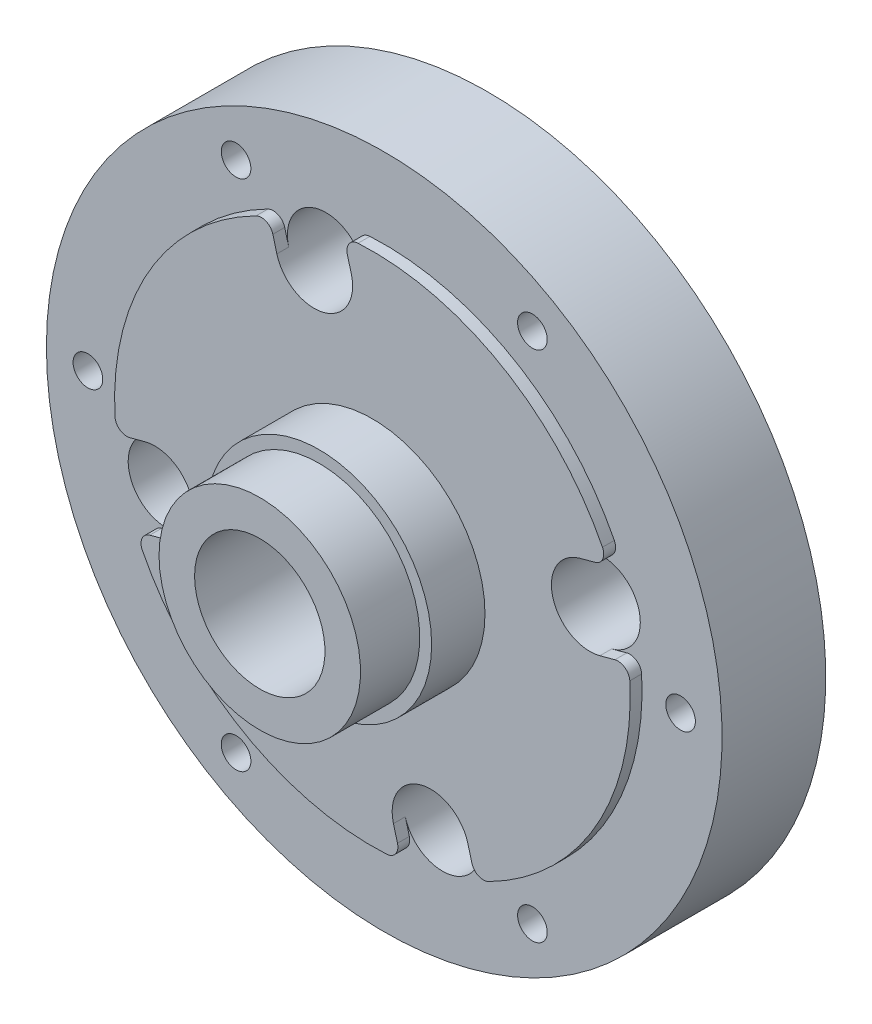
from build123d import *

# Parameters (mm, degrees)
SKETCH_1_W                    = 28.5
SKETCH_1_H                    = 8.75
EXTRUDE_1_DEPTH               = 1
HOLE_WIZARD_M10_1_D           = 11
HOLE_WIZARD_M10_1_CBORE_D     = 28.5
HOLE_WIZARD_M10_1_CBORE_DEPTH = 6.75
HOLE_WIZARD_2_5_2_5_1_D       = 2.5
HOLE_WIZARD_2_5_2_5_1_DEPTH   = 19.25
FILLET_1_R                    = 1


with BuildPart() as part:
    # 草图1 → 旋转1 (revolve)
    with BuildSketch(Plane.XZ, mode=Mode.PRIVATE) as revolve_1_sk:
        with Locations((14.25, 4.375)):
            Rectangle(SKETCH_1_W, SKETCH_1_H)
    revolve(revolve_1_sk.sketch.rotate(Axis((0, 0, 8.75), (0, 0, -1)), 180), axis=Axis((0, 0, 8.75), (0, 0, -1)))

    # 草图2 → 凸台-拉伸1 (add)
    with BuildSketch(Plane.XY.offset(8.75)):
        with BuildLine():
            Line((-8.705372964, 19.931858457), (-8.056820792, 17.511428803))
            ThreePointArc((-8.056820792, 17.511428803), (-5.758723754, 21.491849635), (-1.778302922, 19.193752596))
            Line((-1.778302922, 19.193752596), (-2.426855093, 21.614182251))
            ThreePointArc((-2.426855093, 21.614182251), (10.875, 18.836052532), (19.931858457, 8.705372964))
            Line((19.931858457, 8.705372964), (17.511428803, 8.056820792))
            ThreePointArc((17.511428803, 8.056820792), (21.491849635, 5.758723754), (19.193752596, 1.778302922))
            Line((19.193752596, 1.778302922), (21.614182251, 2.426855093))
            ThreePointArc((21.614182251, 2.426855093), (18.836052532, -10.875), (8.705372964, -19.931858457))
            Line((8.705372964, -19.931858457), (8.056820792, -17.511428803))
            ThreePointArc((8.056820792, -17.511428803), (5.758723754, -21.491849635), (1.778302922, -19.193752596))
            Line((1.778302922, -19.193752596), (2.426855093, -21.614182251))
            ThreePointArc((2.426855093, -21.614182251), (-10.875, -18.836052532), (-19.931858457, -8.705372964))
            Line((-19.931858457, -8.705372964), (-17.511428803, -8.056820792))
            ThreePointArc((-17.511428803, -8.056820792), (-21.491849635, -5.758723754), (-19.193752596, -1.778302922))
            Line((-19.193752596, -1.778302922), (-21.614182251, -2.426855093))
            ThreePointArc((-21.614182251, -2.426855093), (-18.836052532, 10.875), (-8.705372964, 19.931858457))
        make_face()
    extrude(amount=EXTRUDE_1_DEPTH)

    # 草图3 → 旋转2 (revolve)
    with BuildSketch(Plane.XZ, mode=Mode.PRIVATE) as revolve_2_sk:
        Polygon((8.5, 19.25), (0, 19.25), (0, 9.75), (9.5, 9.75), (9.5, 14.25), (8.5, 14.25), align=None)
    revolve(revolve_2_sk.sketch.rotate(Axis((0, 0, 19.25), (0, 0, -1)), 180), axis=Axis((0, 0, 19.25), (0, 0, -1)))

    # 草图4 → 切除-旋转1 (revolve, cut)
    with BuildSketch(Plane(origin=(0, -18.352590699, 0), x_dir=(1, 0, 0), z_dir=(0, 1, 0))):
        Polygon((6.617561857, 0), (4.917561857, 0), (4.917561857, -9.75), (8.167561857, -9.75), (8.167561857, -2.5), (6.617561857, -2.5), align=None)
    revolve(axis=Axis((4.917561857, -18.352590699, 0), (0, 0, 1)), mode=Mode.SUBTRACT)

    # 草图5 → 切除-旋转2 (revolve, cut)
    with BuildSketch(Plane(origin=(0, -4.917561857, 0), x_dir=(1, 0, 0), z_dir=(0, 1, 0))):
        Polygon((-16.652590699, 0), (-18.352590699, 0), (-18.352590699, -9.75), (-15.102590699, -9.75), (-15.102590699, -2.5), (-16.652590699, -2.5), align=None)
    revolve(axis=Axis((-18.352590699, -4.917561857, 0), (0, 0, 1)), mode=Mode.SUBTRACT)

    # 草图6 → 切除-旋转3 (revolve, cut)
    with BuildSketch(Plane(origin=(0, 18.352590699, 0), x_dir=(1, 0, 0), z_dir=(0, 1, 0))):
        Polygon((-3.217561857, 0), (-4.917561857, 0), (-4.917561857, -9.75), (-1.667561857, -9.75), (-1.667561857, -2.5), (-3.217561857, -2.5), align=None)
    revolve(axis=Axis((-4.917561857, 18.352590699, 0), (0, 0, 1)), mode=Mode.SUBTRACT)

    # 草图7 → 切除-旋转4 (revolve, cut)
    with BuildSketch(Plane(origin=(0, 4.917561857, 0), x_dir=(1, 0, 0), z_dir=(0, 1, 0))):
        Polygon((20.052590699, 0), (18.352590699, 0), (18.352590699, -9.75), (21.602590699, -9.75), (21.602590699, -2.5), (20.052590699, -2.5), align=None)
    revolve(axis=Axis((18.352590699, 4.917561857, 0), (0, 0, 1)), mode=Mode.SUBTRACT)

    # M10 六角头螺栓的柱形沉头孔1 (through all)
    with Locations(Plane(origin=(0, 0, 0), x_dir=(-1, 0, 0), z_dir=(0, 0, -1))):
        with Locations((0, 0)):
            CounterBoreHole(HOLE_WIZARD_M10_1_D / 2, HOLE_WIZARD_M10_1_CBORE_D / 2, HOLE_WIZARD_M10_1_CBORE_DEPTH)

    # Ø2.5 (2.5) 直径孔1
    with Locations(Plane(origin=(0, 0, 0), x_dir=(-1, 0, 0), z_dir=(0, 0, -1))):
        with Locations((-25, 0), (-12.5, 21.650635095), (12.5, 21.650635095), (25, 0), (12.5, -21.650635095), (-12.5, -21.650635095)):
            Hole(HOLE_WIZARD_2_5_2_5_1_D / 2, depth=HOLE_WIZARD_2_5_2_5_1_DEPTH)

    # 圆角1
    fillet_1_edges = [part.edges().sort_by_distance(p)[0] for p in [
        (-8.705372964, 19.931858457, 9.25),
        (-21.614182251, -2.426855093, 9.25),
        (-19.931858457, -8.705372964, 9.25),
        (2.426855093, -21.614182251, 9.25),
        (8.705372964, -19.931858457, 9.25),
        (21.614182251, 2.426855093, 9.25),
        (19.931858457, 8.705372964, 9.25),
        (-2.426855093, 21.614182251, 9.25),
    ]]
    fillet(fillet_1_edges, radius=FILLET_1_R)


solid = part.part
